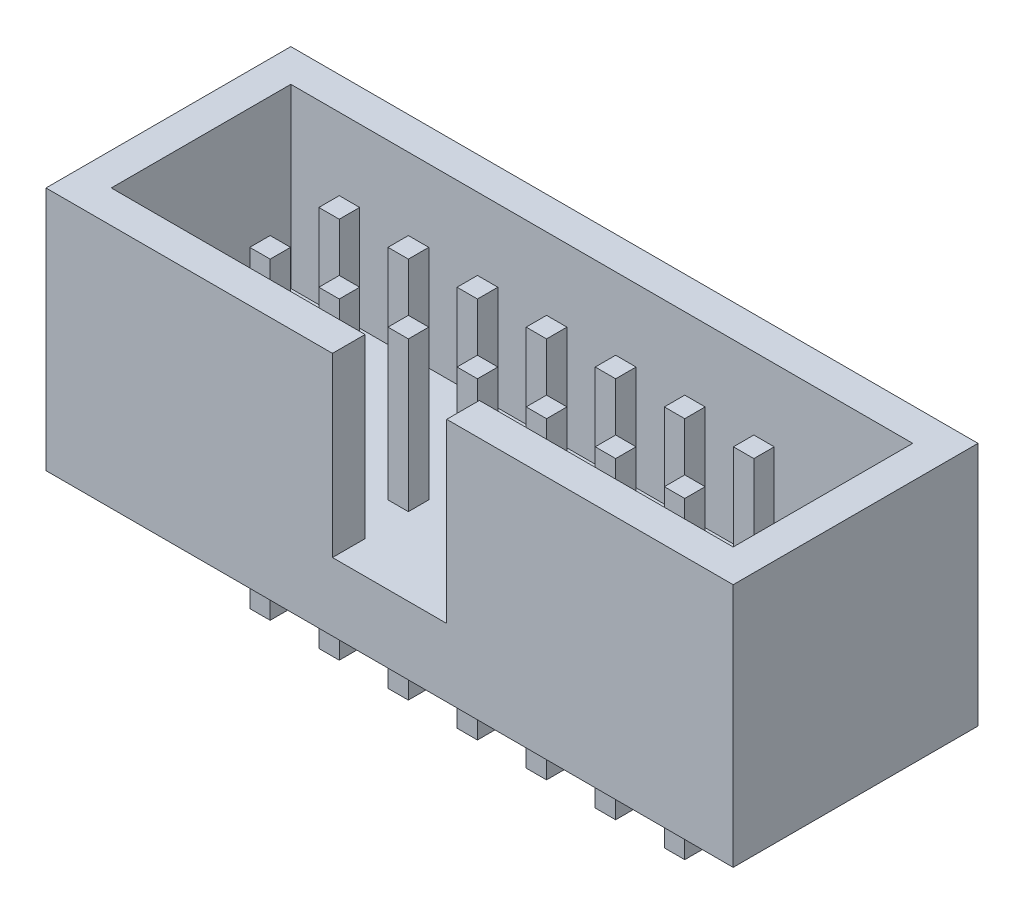
from build123d import *

# Parameters (mm, degrees)
SKETCH_1_W           = 25.26
SKETCH_1_H           = 9
EXTRUDE_1_DEPTH      = 9
SKETCH_2_W           = 22.86
SKETCH_2_H           = 6.6
CUT_EXTRUDE_1_DEPTH  = 6.5
SKETCH_3_W           = 4.2
SKETCH_3_H           = 6.5
CUT_EXTRUDE_2_DEPTH  = 6.5
EXTRUDE_2_DEPTH      = 3.5
EXTRUDE_2_DEPTH_BACK = 8
SKETCH_5_W           = 0.75
SKETCH_5_H           = 0.75


with BuildPart() as part:
    # 草图1 → 拉伸1 (new body)
    with BuildSketch(Plane(origin=(0, 0, 0), x_dir=(1, 0, 0), z_dir=(0, 1, 0))):
        Rectangle(SKETCH_1_W, SKETCH_1_H)
    extrude(amount=EXTRUDE_1_DEPTH)

    # 草图2 → 切除-拉伸1 (cut)
    with BuildSketch(Plane(origin=(0, 9, 0), x_dir=(-1, 0, 0), z_dir=(0, 1, 0))):
        Rectangle(SKETCH_2_W, SKETCH_2_H)
    extrude(amount=-CUT_EXTRUDE_1_DEPTH, mode=Mode.SUBTRACT)

    # 草图3 → 切除-拉伸2 (cut)
    with BuildSketch(Plane.XY.offset(4.5)):
        with Locations((0, 5.75)):
            Rectangle(SKETCH_3_W, SKETCH_3_H)
    extrude(amount=-CUT_EXTRUDE_2_DEPTH, mode=Mode.SUBTRACT)

    # 草图5 → 拉伸2 (add, two sides: drawn at the far end of the back side and taken through both)
    with BuildSketch(Plane.XZ.offset(-EXTRUDE_2_DEPTH_BACK)):
        with Locations((0, 1.27)):
            Rectangle(SKETCH_5_W, SKETCH_5_H)
        with Locations((2.54, 1.27)):
            Rectangle(SKETCH_5_W, SKETCH_5_H)
        with Locations((5.08, 1.27)):
            Rectangle(SKETCH_5_W, SKETCH_5_H)
        with Locations((7.62, 1.27)):
            Rectangle(SKETCH_5_W, SKETCH_5_H)
        with Locations((-2.54, 1.27)):
            Rectangle(SKETCH_5_W, SKETCH_5_H)
        with Locations((-5.08, 1.27)):
            Rectangle(SKETCH_5_W, SKETCH_5_H)
        with Locations((-7.62, 1.27)):
            Rectangle(SKETCH_5_W, SKETCH_5_H)
        with Locations((-7.62, -1.27)):
            Rectangle(SKETCH_5_W, SKETCH_5_H)
        with Locations((-5.08, -1.27)):
            Rectangle(SKETCH_5_W, SKETCH_5_H)
        with Locations((-2.54, -1.27)):
            Rectangle(SKETCH_5_W, SKETCH_5_H)
        with Locations((7.62, -1.27)):
            Rectangle(SKETCH_5_W, SKETCH_5_H)
        with Locations((5.08, -1.27)):
            Rectangle(SKETCH_5_W, SKETCH_5_H)
        with Locations((2.54, -1.27)):
            Rectangle(SKETCH_5_W, SKETCH_5_H)
        with Locations((0, -1.27)):
            Rectangle(SKETCH_5_W, SKETCH_5_H)
    extrude(amount=EXTRUDE_2_DEPTH + EXTRUDE_2_DEPTH_BACK)


solid = part.part
